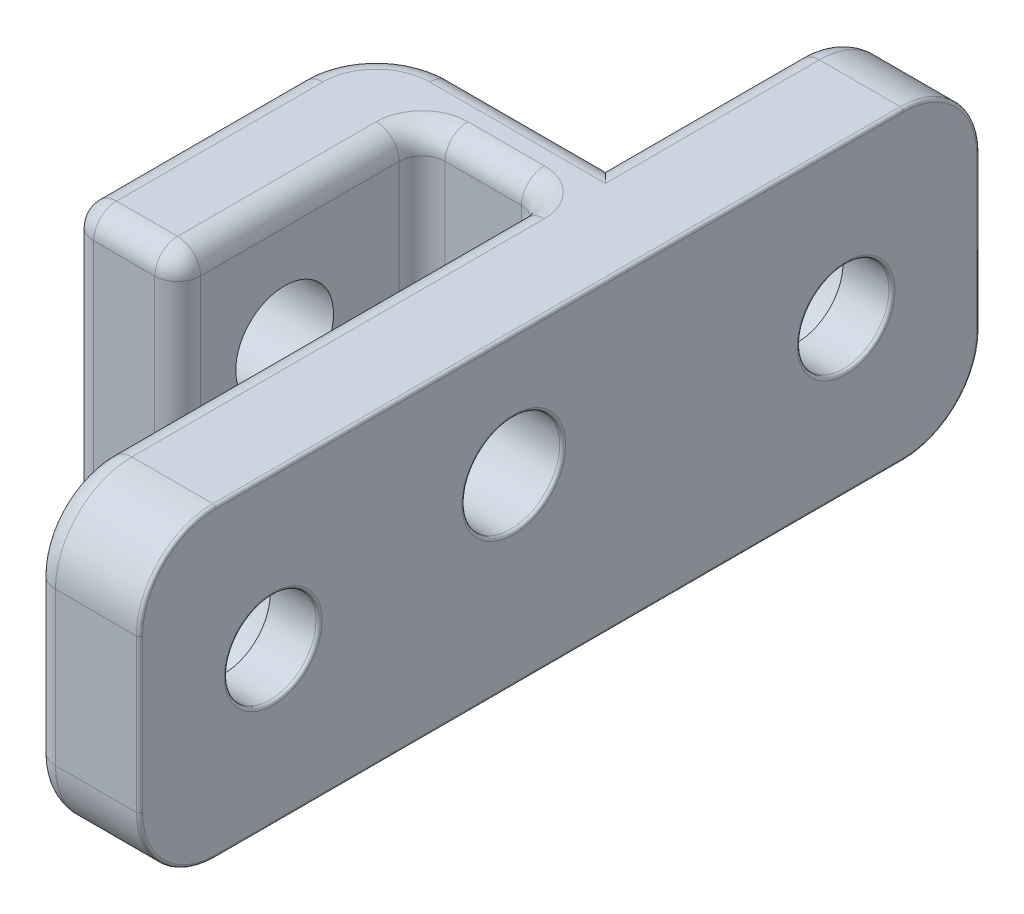
from build123d import *

# Parameters (mm, degrees)
BOSS_EXTRUDE1_DEPTH = 10
BOSS_EXTRUDE2_START = -10
SKETCH1_3_W         = 8
SKETCH1_3_H         = 16
BOSS_EXTRUDE2_DEPTH = 4
CUT_EXTRUDE1_DEPTH  = 20
CUT_EXTRUDE2_REACH  = 40.913
SKETCH2_4_R         = 3
CUT_EXTRUDE3_START  = -3.2
SKETCH2_5_R         = 4.75
SKETCH2_5_R_2       = 3
CUT_EXTRUDE3_DEPTH  = 3.8
CUT_EXTRUDE4_START  = -20
SKETCH3_W           = 3
SKETCH3_H           = 3
CUT_EXTRUDE4_DEPTH  = 0.3
CUT_EXTRUDE5_START  = -20.6
SKETCH3_3_W         = 3
SKETCH3_3_H         = 3
CUT_EXTRUDE5_DEPTH  = 0.3
FILLET1_R           = 5
FILLET2_R           = 1.5
FILLET4_R           = 1
FILLET3_R           = 0.2


with BuildPart() as part:
    # Sketch1 → Boss-Extrude1 (new, symmetric)
    with BuildSketch(Plane(origin=(0, 0, 0), x_dir=(1, 0, 0), z_dir=(0, 1, 0))):
        Polygon((-4, 9), (-4, -7), (-11, -7), (-11, 13), (4, 13), (4, 30.5), (11, 30.5), (11, -24.5), (4, -24.5), (4, 9), align=None)
    extrude(amount=BOSS_EXTRUDE1_DEPTH, both=True)

    # Sketch1<3> → Boss-Extrude2 (add)
    with BuildSketch(Plane(origin=(0, 0, 0), x_dir=(1, 0, 0), z_dir=(0, 1, 0)).offset(BOSS_EXTRUDE2_START)):
        with Locations((0, 1)):
            Rectangle(SKETCH1_3_W, SKETCH1_3_H)
    extrude(amount=BOSS_EXTRUDE2_DEPTH)

    # Sketch2 → Cut-Extrude1 (cut)
    with BuildSketch(Plane(origin=(11, 0, 0), x_dir=(0, 0, -1), z_dir=(1, 0, 0))):
        with BuildLine():
            ThreePointArc((3.2, 2), (2.2627417, 4.2627417), (0, 5.2))
            Line((0, 5.2), (0, -1.2))
            ThreePointArc((0, -1.2), (2.2627417, -0.2627417), (3.2, 2))
        make_face()
        with BuildLine():
            Line((0, -1.2), (0, 5.2))
            ThreePointArc((0, 5.2), (-3.2, 2), (0, -1.2))
        make_face()
    extrude(amount=-CUT_EXTRUDE1_DEPTH, mode=Mode.SUBTRACT)

    # Sketch2<4> → Cut-Extrude2 (cut, up to next)
    with BuildSketch(Plane(origin=(11, 0, 0), x_dir=(0, 0, -1), z_dir=(1, 0, 0)), mode=Mode.PRIVATE) as cut_extrude2_sk1:
        with Locations((-15.75, 0)):
            Circle(SKETCH2_4_R)
    cut_extrude2_tool1 = extrude(cut_extrude2_sk1.sketch, amount=-CUT_EXTRUDE2_REACH, mode=Mode.PRIVATE) & part.part
    # Sketch2<4> → Cut-Extrude2 (cut, up to next)
    with BuildSketch(Plane(origin=(11, 0, 0), x_dir=(0, 0, -1), z_dir=(1, 0, 0)), mode=Mode.PRIVATE) as cut_extrude2_sk2:
        with Locations((21.75, 0)):
            Circle(SKETCH2_4_R)
    cut_extrude2_tool2 = extrude(cut_extrude2_sk2.sketch, amount=-CUT_EXTRUDE2_REACH, mode=Mode.PRIVATE) & part.part
    add(cut_extrude2_tool1.solids().sort_by_distance((11, 0, 15.75))[0], mode=Mode.SUBTRACT)
    add(cut_extrude2_tool2.solids().sort_by_distance((11, 0, -21.75))[0], mode=Mode.SUBTRACT)

    # Sketch2<5> → Cut-Extrude3 (cut)
    # profile 1 of 2: a face of its own
    with BuildSketch(Plane(origin=(11, 0, 0), x_dir=(0, 0, -1), z_dir=(1, 0, 0)).offset(CUT_EXTRUDE3_START)):
        with Locations(Location((-15.75, 0, 0), (0, 0, 180))):
            Circle(SKETCH2_5_R)
        with Locations((-15.75, 0)):
            Circle(SKETCH2_5_R_2, mode=Mode.SUBTRACT)
    # profile 2 of 2: a face of its own
    with BuildSketch(Plane(origin=(11, 0, 0), x_dir=(0, 0, -1), z_dir=(1, 0, 0)).offset(CUT_EXTRUDE3_START)):
        with Locations(Location((21.75, 0, 0), (0, 0, 180))):
            Circle(SKETCH2_5_R)
        with Locations((21.75, 0)):
            Circle(SKETCH2_5_R_2, mode=Mode.SUBTRACT)
    extrude(amount=-CUT_EXTRUDE3_DEPTH, mode=Mode.SUBTRACT)

    # Sketch3 → Cut-Extrude4 (cut)
    with BuildSketch(Plane(origin=(11, 0, 0), x_dir=(0, 0, -1), z_dir=(1, 0, 0)).offset(CUT_EXTRUDE4_START)):
        with Locations((0, 2)):
            Rectangle(SKETCH3_W, SKETCH3_H)
        with BuildLine():
            Line((1.5, 3.5), (1.5, 0.5))
            Line((1.5, 0.5), (2.826658805, 0.5))
            ThreePointArc((2.826658805, 0.5), (3.105262322, 1.227118436), (3.2, 2))
            ThreePointArc((3.2, 2), (3.105262322, 2.772881564), (2.826658805, 3.5))
            Line((2.826658805, 3.5), (1.5, 3.5))
        make_face()
        with BuildLine():
            Line((-2.826658805, 0.5), (-1.5, 0.5))
            Line((-1.5, 0.5), (-1.5, 3.5))
            Line((-1.5, 3.5), (-2.826658805, 3.5))
            ThreePointArc((-2.826658805, 3.5), (-3.105262322, 2.772881564), (-3.2, 2))
            ThreePointArc((-3.2, 2), (-3.105262322, 1.227118436), (-2.826658805, 0.5))
        make_face()
    extrude(amount=-CUT_EXTRUDE4_DEPTH, mode=Mode.SUBTRACT)

    # Sketch3<3> → Cut-Extrude5 (cut)
    with BuildSketch(Plane(origin=(11, 0, 0), x_dir=(0, 0, -1), z_dir=(1, 0, 0)).offset(CUT_EXTRUDE5_START)):
        with Locations((0, 2)):
            Rectangle(SKETCH3_3_W, SKETCH3_3_H)
    extrude(amount=CUT_EXTRUDE5_DEPTH, mode=Mode.SUBTRACT)

    # Fillet1
    fillet1_edges = [part.edges().sort_by_distance(p)[0] for p in [
        (7.5, -10, -30.5),
        (7.5, -10, 24.5),
        (-11, 0, -13),
        (7.5, 10, 24.5),
        (7.5, 10, -30.5),
    ]]
    fillet(fillet1_edges, radius=FILLET1_R)

    # Fillet2
    fillet2_edges = [part.edges().sort_by_distance(p)[0] for p in [
        (4, -10, 13.25),
        (0, 10, -9),
        (-9.535533906, -10, -11.535533906),
        (4, 10, 5.25),
        (-9.535533906, 10, -11.535533906),
        (4, 0, -30.5),
        (-3.5, -10, 7),
        (4, -8.535533906, -29.035533906),
        (-11, -10, -0.5),
        (4, 8.535533906, -29.035533906),
        (4, 0, 24.5),
        (4, 8.535533906, 23.035533906),
        (4, -8.535533906, 23.035533906),
        (-1, -10, -13),
        (4, -10, -19.25),
        (-4, 2, 7),
        (-11, 0, 7),
        (4, 2, -9),
        (-4, 2, -9),
        (4, 10, -19.25),
        (4, -8, 7),
        (0, -6, -9),
        (-4, -6, -1),
        (0, -6, 7),
        (4, -6, -1),
        (-1, 10, -13),
        (-11, 10, -0.5),
        (-7.5, 10, 7),
        (-4, 10, -1),
    ]]
    fillet(fillet2_edges, radius=FILLET2_R)

    # Fillet4
    fillet4_edges = [part.edges().sort_by_distance(p)[0] for p in [
        (4, 0, 11),
        (4, 0, -26.5),
    ]]
    fillet(fillet4_edges, radius=FILLET4_R)

    # Fillet3
    fillet3_edges = [part.edges().sort_by_distance(p)[0] for p in [
        (11, -10, -3),
        (11, 10, -3),
        (11, 0, -30.5),
        (11, 0, 24.5),
        (11, 8.535533906, 23.035533906),
        (11, -8.535533906, 23.035533906),
        (11, -8.535533906, -29.035533906),
        (11, 8.535533906, -29.035533906),
        (11, -1.2, 0),
        (11, 0, 18.75),
        (11, 0, -18.75),
    ]]
    fillet(fillet3_edges, radius=FILLET3_R)


solid = part.part
